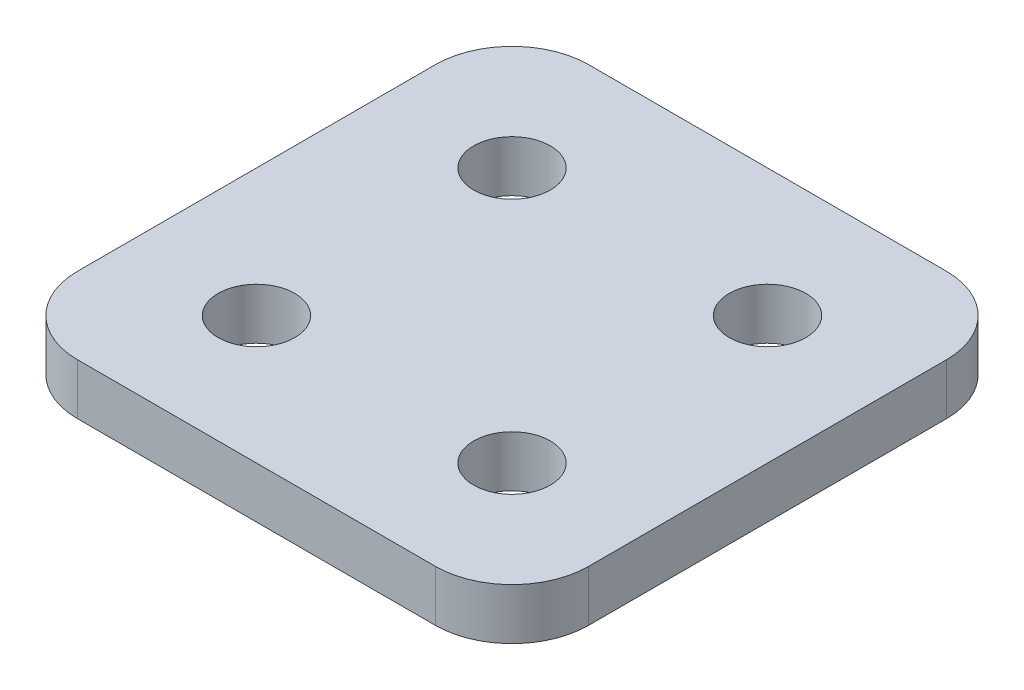
from build123d import *

# Parameters (mm, degrees)
SKETCH_1_W          = 20
SKETCH_1_H          = 20
EXTRUDE_1_DEPTH     = 2
SKETCH_2_R          = 1.5
CUT_EXTRUDE_1_DEPTH = 15.282856857
FILLET_1_R          = 3


with BuildPart() as part:
    # 草图1 → 凸台-拉伸1 (new body)
    with BuildSketch(Plane(origin=(0, 0, 0), x_dir=(1, 0, 0), z_dir=(0, 1, 0))):
        Rectangle(SKETCH_1_W, SKETCH_1_H)
    extrude(amount=EXTRUDE_1_DEPTH)

    # 草图2 → 切除-拉伸1 (cut, through all)
    with BuildSketch(Plane(origin=(0, 2, 0), x_dir=(1, 0, 0), z_dir=(0, 1, 0))):
        with Locations(Location((-5, 5, 0), (0, 0, 270))):
            Circle(SKETCH_2_R)
        with Locations(Location((5, 5, 0), (0, 0, 270))):
            Circle(SKETCH_2_R)
        with Locations(Location((-5, -5, 0), (0, 0, 270))):
            Circle(SKETCH_2_R)
        with Locations(Location((5, -5, 0), (0, 0, 270))):
            Circle(SKETCH_2_R)
    extrude(amount=-CUT_EXTRUDE_1_DEPTH, mode=Mode.SUBTRACT)

    # 圆角1
    fillet_1_edges = [part.edges().sort_by_distance(p)[0] for p in [
        (10, 1, 10),
        (-10, 1, 10),
        (-10, 1, -10),
        (10, 1, -10),
    ]]
    fillet(fillet_1_edges, radius=FILLET_1_R)


solid = part.part
